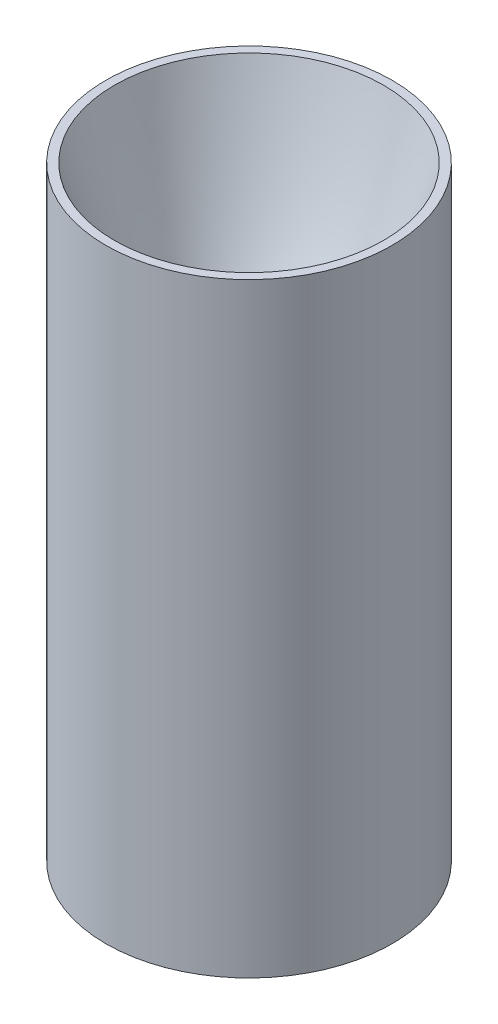
from build123d import *

# Parameters (mm, degrees)
CIRPATTERN1_COUNT              = 8
F_1_4_0_2500_DOWEL_HOLE1_D     = 6.35
F_1_4_0_2500_DOWEL_HOLE1_DEPTH = 9.906
F_1_4_0_2500_DOWEL_HOLE1_TIP   = 1.907732465


with BuildPart() as part:
    # Sketch1 → Revolve2 (revolve)
    with BuildSketch(Plane.XY, mode=Mode.PRIVATE) as revolve2_sk:
        with BuildLine():
            Line((71.638455479, 109.927347077), (76.2, 109.927347077))
            Line((76.2, 109.927347077), (76.2, -212.127673762))
            Line((76.2, -212.127673762), (53.792460107, -212.127673762))
            Line((53.792460107, -212.127673762), (53.792460107, -59.727673762))
            add(Edge.make_bspline(
                [(53.792460107, -59.727673762), (53.792458875, -59.657143693), (53.79192973, -59.515566639), (53.789553877, -59.181725153), (53.783229275, -58.904956029), (53.773743784, -58.532728024), (53.761100883, -58.212998158), (53.741350051, -57.781754979), (53.711337705, -57.281120436), (53.667125535, -56.688158703), (53.588220857, -55.848640904), (53.488359258, -55.0083264), (53.367608174, -54.172595971), (53.197743199, -53.172585782), (53.002996554, -52.177603366), (52.777307477, -51.18869963), (52.520946571, -50.207649587), (52.240221677, -49.233238292), (51.935281065, -48.266129779), (51.544470146, -47.149295627), (51.050452662, -45.89056897), (50.509666041, -44.651129374), (49.922993204, -43.432862102), (49.291052494, -42.237253822), (48.61505748, -41.066315469), (47.895407759, -39.921133254), (47.134034366, -38.804236844), (46.430801278, -37.851612398), (45.804470147, -37.055832742), (45.263749884, -36.403541907), (44.826059146, -35.894408262), (44.425708383, -35.447153291), (44.092389692, -35.084791822), (43.78485681, -34.760500791), (43.58500459, -34.551710093), (43.355324254, -34.318676932), (43.254715332, -34.217322701), (43.204843184, -34.167450314)],
                knots=[0.082637729, 0.082637729, 0.082637729, 0.082637729, 0.082637729, 0.092574926, 0.102512123, 0.11244932, 0.122386517, 0.132323714, 0.142260911, 0.162135305, 0.182009699, 0.201884093, 0.24163288, 0.261507274, 0.281381668, 0.321130456, 0.360879243, 0.380753637, 0.400628031, 0.440376819, 0.480125606, 0.519874394, 0.559623181, 0.599371969, 0.639120757, 0.678869544, 0.718618332, 0.75836712, 0.798115907, 0.817990301, 0.837864695, 0.857739089, 0.877613483, 0.88755068, 0.897487877, 0.907425074, 0.91736227, 0.91736227, 0.91736227, 0.91736227, 0.91736227], degree=4))
            Line((43.204843184, -34.167450314), (34.597214986, -25.559822117))
            add(Edge.make_bspline(
                [(24.01, 0), (24.010001231, -0.070528647), (24.010530378, -0.21358419), (24.012906064, -0.543182916), (24.019230459, -0.824160397), (24.02871558, -1.194822071), (24.041357874, -1.513435058), (24.057158098, -1.861939603), (24.076113357, -2.193706871), (24.103750972, -2.6180694), (24.14321918, -3.122033947), (24.214231842, -3.879978675), (24.334058815, -4.886450388), (24.510418183, -6.05671076), (24.761817375, -7.385166415), (25.062727459, -8.703574514), (25.412702772, -10.009637209), (25.811293135, -11.301819597), (26.257877546, -12.578099335), (26.75193548, -13.836887484), (27.292605281, -15.076197129), (27.879411549, -16.294609794), (28.511071563, -17.489938794), (29.187464564, -18.661287757), (29.906377272, -19.805743397), (30.668954172, -20.923860075), (31.370099368, -21.87441176), (31.9996683, -22.673445481), (32.535060595, -23.320422138), (32.983187947, -23.840005017), (33.419382207, -24.329816247), (33.846758303, -24.78848439), (34.156490822, -25.113868311), (34.44779214, -25.409649047), (34.547344609, -25.509949933), (34.597214986, -25.559822117)],
                knots=[0.082637729, 0.082637729, 0.082637729, 0.082637729, 0.082637729, 0.092574926, 0.102512123, 0.11244932, 0.122386517, 0.132323714, 0.142260911, 0.152198108, 0.162135305, 0.182009699, 0.201884093, 0.24163288, 0.281381668, 0.321130456, 0.360879243, 0.400628031, 0.440376819, 0.480125606, 0.519874394, 0.559623181, 0.599371969, 0.639120757, 0.678869544, 0.718618332, 0.75836712, 0.798115907, 0.817990301, 0.837864695, 0.857739089, 0.877613483, 0.897487877, 0.907425074, 0.91736227, 0.91736227, 0.91736227, 0.91736227, 0.91736227], degree=4))
            add(Edge.make_bspline(
                [(24.01, 0), (24.010000626, 0.035892652), (24.010538457, 0.11011369), (24.012955849, 0.267641069), (24.019393694, 0.427064117), (24.031465725, 0.646764266), (24.052367213, 0.901433328), (24.086116845, 1.202537273), (24.137431431, 1.542050498), (24.201475827, 1.880996777), (24.278073727, 2.21635442), (24.367255697, 2.549239421), (24.468673539, 2.878092645), (24.582551197, 3.203347041), (24.708128897, 3.523627157), (24.846218103, 3.839666733), (24.995002427, 4.149282184), (25.156944348, 4.454783123), (25.327420631, 4.751301575), (25.513446847, 5.045703861), (25.702720396, 5.325518936), (25.9153376, 5.610727543), (26.0898085, 5.832913647), (26.277277882, 6.049951637), (26.415487374, 6.208641646), (26.581374196, 6.382121779), (26.655452387, 6.458478841), (26.706211329, 6.50923965)],
                knots=[0.082568816, 0.082568816, 0.082568816, 0.082568816, 0.082568816, 0.102426634, 0.122284453, 0.142142271, 0.162000089, 0.201715725, 0.241431362, 0.281146998, 0.320862634, 0.360578271, 0.400293907, 0.440009544, 0.47972518, 0.519440816, 0.559156453, 0.598872089, 0.638587725, 0.678303362, 0.718018998, 0.757734635, 0.797450271, 0.837165907, 0.857023726, 0.876881544, 0.91659718, 0.91659718, 0.91659718, 0.91659718, 0.91659718], degree=4))
            add(Edge.make_bspline(
                [(26.706211329, 6.50923965), (49.172333461, 34.635954224), (71.638455479, 109.927347077)],
                knots=[0, 0, 0, 1, 1, 1], degree=2))
        make_face()
    revolve(revolve2_sk.sketch.rotate(Axis((0, 0, 0), (0, -1, 0)), 90), axis=Axis((0, 0, 0), (0, -1, 0)))

    # Sketch4 → 3/8-24 Tapped Hole1 (revolve, cut)
    with BuildSketch(Plane(origin=(66.675, -212.127673762, 0), x_dir=(0, 0, -1), z_dir=(1, 0, 0))):
        Polygon((0, 0), (0, 27.534688714), (4.2164, 25.00122), (4.2164, 0), align=None)
    f_3_8_24_tapped_hole1 = revolve(axis=Axis((66.675, -218.477673762, 0), (0, 1, 0)), mode=Mode.SUBTRACT)

    # CirPattern1: 3/8-24 Tapped Hole1 ×8 about axis
    cirpattern1_axis = Axis((0, 0, 0), (0, 1, 0))
    for i in range(1, CIRPATTERN1_COUNT):
        add(f_3_8_24_tapped_hole1.rotate(cirpattern1_axis, i * 360 / CIRPATTERN1_COUNT), mode=Mode.SUBTRACT)

    # 1/4 (0.2500) Dowel Hole1
    with Locations(Plane(origin=(0, -212.127673762, 0), x_dir=(-1, 0, 0), z_dir=(0, -1, 0))):
        with Locations((-61.59966783, 25.515417853), (61.59966783, -25.515417853)):
            Hole(F_1_4_0_2500_DOWEL_HOLE1_D / 2, depth=F_1_4_0_2500_DOWEL_HOLE1_DEPTH)
            with Locations((0, 0, -(F_1_4_0_2500_DOWEL_HOLE1_DEPTH + F_1_4_0_2500_DOWEL_HOLE1_TIP / 2))):  # 118° drill point
                Cone(0, F_1_4_0_2500_DOWEL_HOLE1_D / 2, F_1_4_0_2500_DOWEL_HOLE1_TIP, mode=Mode.SUBTRACT)


solid = part.part
